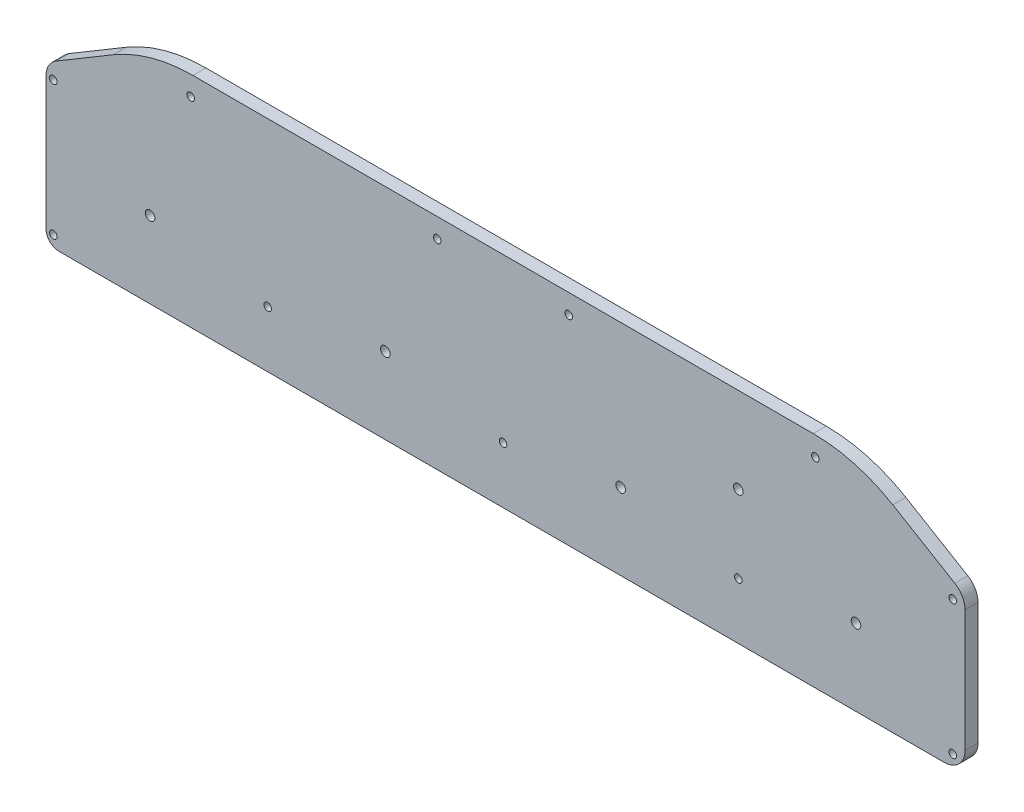
from build123d import *

# Parameters (mm, degrees)
SKETCH1_R           = 2.35
SKETCH1_R_2         = 1.85000011
SKETCH1_R_3         = 1.85
BOSS_EXTRUDE1_DEPTH = 6.35


with BuildPart() as part:
    # Sketch1 → Boss-Extrude1 (new body)
    with BuildSketch(Plane.XY):
        with BuildLine():
            Line((-149.618797812, -37.447756374), (-217.287383527, -37.447756374))
            ThreePointArc((-217.287383527, -37.447756374), (-221.777511587, -35.587884435), (-223.637383527, -31.097756374))
            Line((-223.637383527, -31.097756374), (-223.637383527, 33.765977424))
            ThreePointArc((-223.637383527, 33.765977424), (-222.309818874, 38.787300541), (-218.674059542, 42.49639313))
            Line((-218.674059542, 42.49639313), (-190.732762109, 59.128117792))
            ThreePointArc((-190.732762109, 59.128117792), (-171.969166759, 67.120649159), (-151.757691995, 69.85))
            Line((-151.757691995, 69.85), (151.757691995, 69.85))
            ThreePointArc((151.757691995, 69.85), (171.969166759, 67.120649159), (190.732762109, 59.128117792))
            Line((190.732762109, 59.128117792), (221.096676015, 41.054359515))
            ThreePointArc((221.096676015, 41.054359515), (224.732435347, 37.345266926), (226.06, 32.323943809))
            Line((226.06, 32.323943809), (226.06, -27.287756374))
            ThreePointArc((226.06, -27.287756374), (223.084204897, -34.471961271), (215.9, -37.447756374))
            Line((215.9, -37.447756374), (-149.618797812, -37.447756374))
        make_face()
        with Locations((-172.72, 0)):
            Circle(SKETCH1_R, mode=Mode.SUBTRACT)
        with Locations((-57.57418, 0)):
            Circle(SKETCH1_R, mode=Mode.SUBTRACT)
        with Locations((57.5724782, 0)):
            Circle(SKETCH1_R, mode=Mode.SUBTRACT)
        with Locations((172.72, 0)):
            Circle(SKETCH1_R, mode=Mode.SUBTRACT)
        with Locations((220.058830169, -31.752755237)):
            Circle(SKETCH1_R_2, mode=Mode.SUBTRACT)
        with Locations((115.1462391, 27.951065379)):
            Circle(SKETCH1_R, mode=Mode.SUBTRACT)
        with Locations((-220.058830169, -31.752755237)):
            Circle(SKETCH1_R_2, mode=Mode.SUBTRACT)
        with Locations((-32.17418, 60.325)):
            Circle(SKETCH1_R_3, mode=Mode.SUBTRACT)
        with Locations((-152.82418, 60.325)):
            Circle(SKETCH1_R_3, mode=Mode.SUBTRACT)
        with Locations((152.82418, 60.325)):
            Circle(SKETCH1_R_3, mode=Mode.SUBTRACT)
        with Locations((32.17418, 60.325)):
            Circle(SKETCH1_R_3, mode=Mode.SUBTRACT)
        with Locations((115.1453882, -9.897181959)):
            Circle(SKETCH1_R_3, mode=Mode.SUBTRACT)
        with Locations((-115.14709, -9.897181959)):
            Circle(SKETCH1_R_3, mode=Mode.SUBTRACT)
        with Locations((-0.00127, -9.897181959)):
            Circle(SKETCH1_R_3, mode=Mode.SUBTRACT)
        with Locations((220.058830169, 33.81345012)):
            Circle(SKETCH1_R_3, mode=Mode.SUBTRACT)
        with Locations((-220.058830169, 33.81345012)):
            Circle(SKETCH1_R_3, mode=Mode.SUBTRACT)
    extrude(amount=BOSS_EXTRUDE1_DEPTH)


solid = part.part
